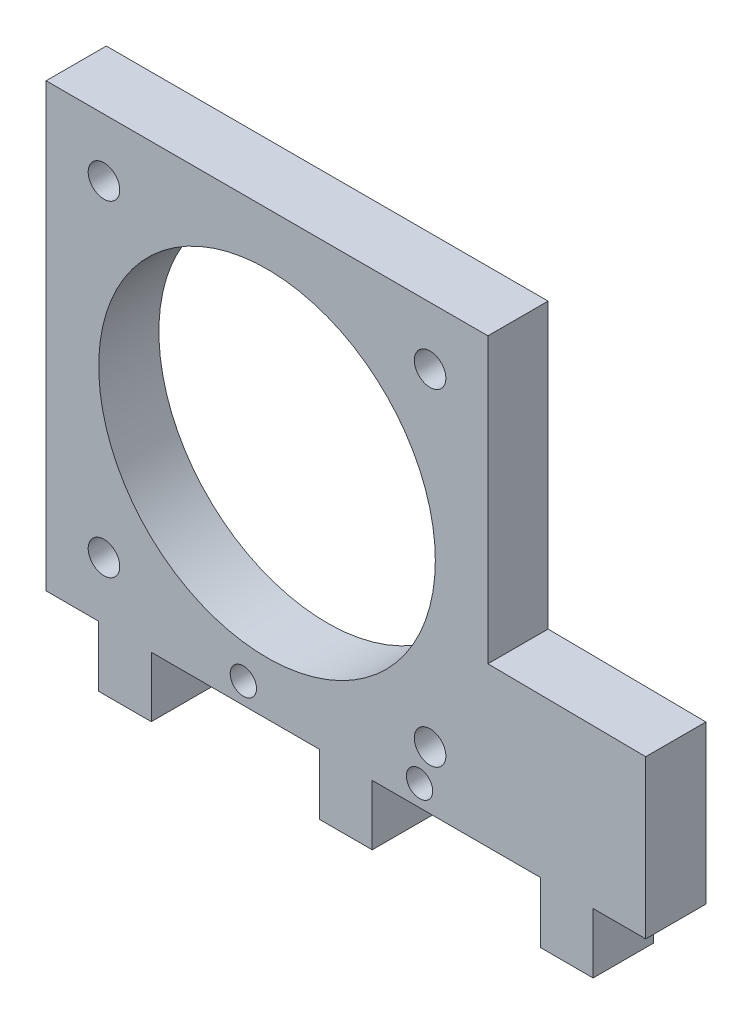
from build123d import *

# Parameters (mm, degrees)
SKETCH1_R           = 16
SKETCH1_R_2         = 1.25
SKETCH1_R_3         = 1.5
BOSS_EXTRUDE1_DEPTH = 5.72


with BuildPart() as part:
    # Sketch1 → Boss-Extrude1 (new body)
    with BuildSketch(Plane.XY):
        Polygon((9.38, 32.147938931), (9.38, 5.147938931), (24.38, 5), (24.38, -10), (19.38, -10), (19.38, -15.72), (14.38, -15.72), (14.38, -9.950687023), (-1.62, -9.950687023), (-1.62, -15.670687023), (-6.62, -15.670687023), (-6.62, -9.901374046), (-22.62, -9.901374046), (-22.62, -15.621374046), (-27.62, -15.621374046), (-27.62, -9.852061069), (-32.62, -9.852061069), (-32.62, 32.147938931), align=None)
        with Locations((-11.62, 11.147938931)):
            Circle(SKETCH1_R, mode=Mode.SUBTRACT)
        with Locations((2.88, -7.950687023)):
            Circle(SKETCH1_R_2, mode=Mode.SUBTRACT)
        with Locations((-13.87, -7.901374046)):
            Circle(SKETCH1_R_2, mode=Mode.SUBTRACT)
        with Locations((3.879843111, -4.450687023)):
            Circle(SKETCH1_R_3, mode=Mode.SUBTRACT)
        with Locations((-27.12, -4.352061069)):
            Circle(SKETCH1_R_3, mode=Mode.SUBTRACT)
        with Locations((-27.12, 26.647938931)):
            Circle(SKETCH1_R_3, mode=Mode.SUBTRACT)
        with Locations((3.88, 26.647938931)):
            Circle(SKETCH1_R_3, mode=Mode.SUBTRACT)
    extrude(amount=BOSS_EXTRUDE1_DEPTH)


solid = part.part
